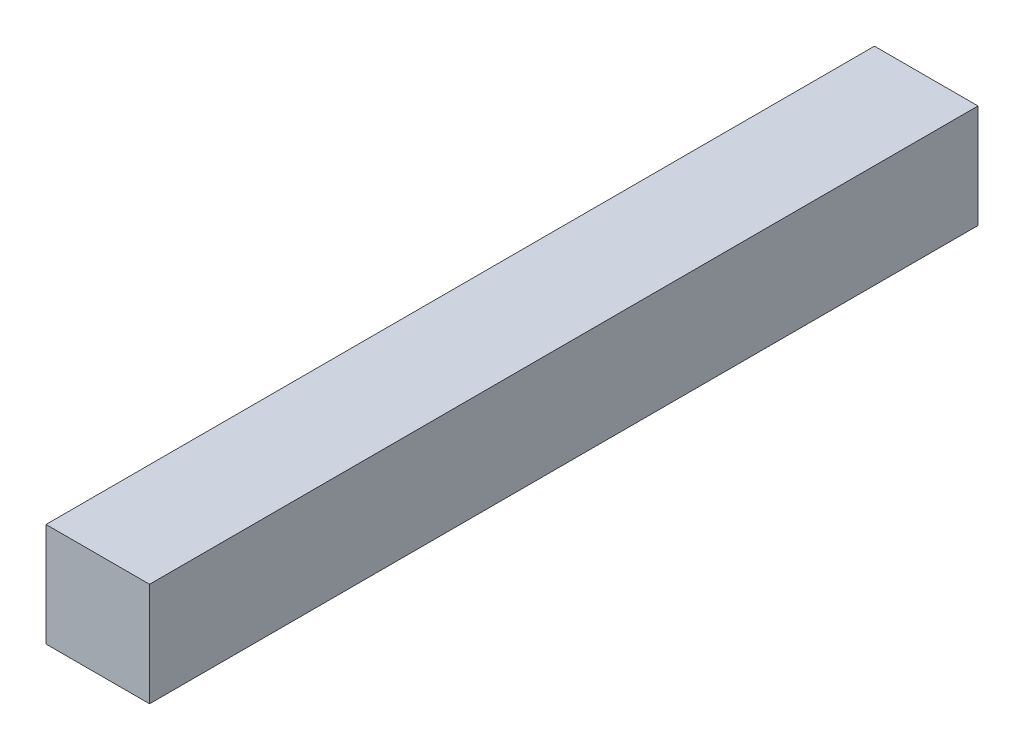
from build123d import *

# Parameters (mm, degrees)
SKETCH1_W           = 3.175
SKETCH1_H           = 3.175
BOSS_EXTRUDE1_DEPTH = 25.4


with BuildPart() as part:
    # Sketch1 → Boss-Extrude1 (new body)
    with BuildSketch(Plane.XY):
        Rectangle(SKETCH1_W, SKETCH1_H)
    extrude(amount=BOSS_EXTRUDE1_DEPTH)


solid = part.part
